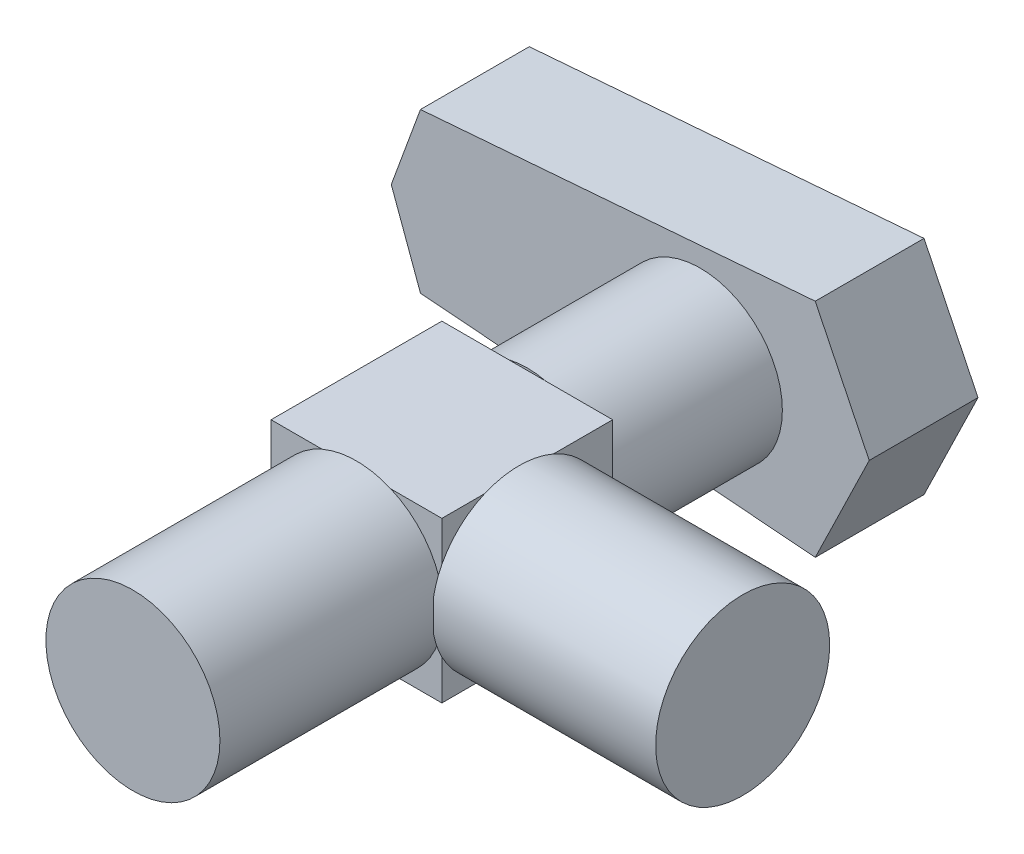
from build123d import *

# Parameters (mm, degrees)
BOSS_EXTRUDE2_DEPTH      = 7.35
BOSS_EXTRUDE2_DEPTH_BACK = 7.35
SKETCH2_W                = 15.7
SKETCH2_H                = 15.7
SKETCH3_R                = 8
BOSS_EXTRUDE3_DEPTH      = 20.55
SKETCH4_R                = 7.55
BOSS_EXTRUDE4_DEPTH      = 25.9
BOSS_EXTRUDE5_DEPTH      = 10
SKETCH6_R                = 8
BOSS_EXTRUDE6_DEPTH      = 20.55


with BuildPart() as part:
    # Sketch2 → Boss-Extrude2 (new, two sides: drawn at the far end of the back side and taken through both)
    with BuildSketch(Plane(origin=(0, 0, 0), x_dir=(1, 0, 0), z_dir=(0, 1, 0)).offset(-BOSS_EXTRUDE2_DEPTH_BACK)):
        Rectangle(SKETCH2_W, SKETCH2_H)
    extrude(amount=BOSS_EXTRUDE2_DEPTH + BOSS_EXTRUDE2_DEPTH_BACK)

    # Sketch3 → Boss-Extrude3 (add)
    with BuildSketch(Plane(origin=(7.85, 0, 0), x_dir=(0, 0, -1), z_dir=(1, 0, 0))):
        with Locations((-0.75, 0)):
            Circle(SKETCH3_R)
    extrude(amount=BOSS_EXTRUDE3_DEPTH)

    # Sketch4 → Boss-Extrude4 (add)
    with BuildSketch(Plane(origin=(0, 0, -7.85), x_dir=(-1, 0, 0), z_dir=(0, 0, -1))):
        Circle(SKETCH4_R)
    extrude(amount=BOSS_EXTRUDE4_DEPTH)

    # Sketch5 → Boss-Extrude5 (add)
    with BuildSketch(Plane(origin=(0, 0, -33.75), x_dir=(-1, 0, 0), z_dir=(0, 0, -1))):
        Polygon((-15.532193585, 0), (-10.572107213, -10.198544939), (25.717504309, -7.313596743), (28.4, 0), (25.717504309, 7.313596743), (-10.572107213, 10.198544939), align=None)
    extrude(amount=-BOSS_EXTRUDE5_DEPTH)

    # Sketch6 → Boss-Extrude6 (add)
    with BuildSketch(Plane.XY.offset(7.85)):
        Circle(SKETCH6_R)
    extrude(amount=BOSS_EXTRUDE6_DEPTH)


solid = part.part
